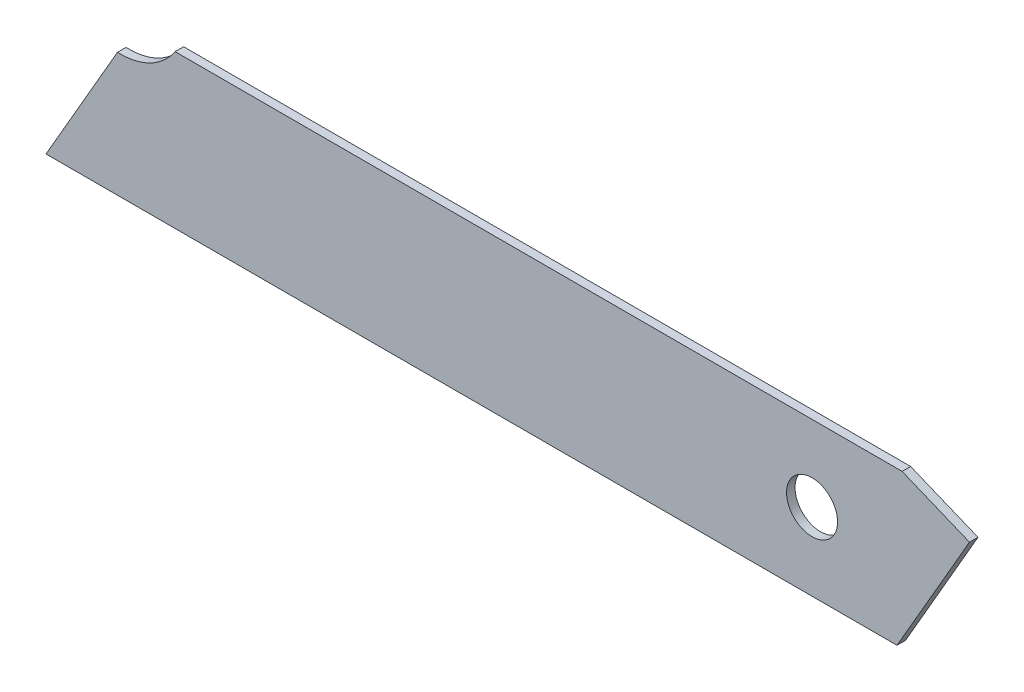
from build123d import *

# Parameters (mm, degrees)
SKETCH1_R           = 3
BOSS_EXTRUDE1_DEPTH = 1


with BuildPart() as part:
    # Sketch1 → Boss-Extrude1 (new body)
    with BuildSketch(Plane.XY):
        with BuildLine():
            Line((8.399507831, 14.548374322), (0, 0))
            Line((0, 0), (100, 0))
            Line((100, 0), (108.516319797, 14.750698581))
            Line((108.516319797, 14.750698581), (100.60138269, 18))
            Line((100.60138269, 18), (15.167032503, 18))
            ThreePointArc((15.167032503, 18), (12.241054752, 15.376619242), (8.399507831, 14.548374322))
        make_face()
        with Locations((90.015809824, 9.06195858)):
            Circle(SKETCH1_R, mode=Mode.SUBTRACT)
    extrude(amount=BOSS_EXTRUDE1_DEPTH)


solid = part.part
